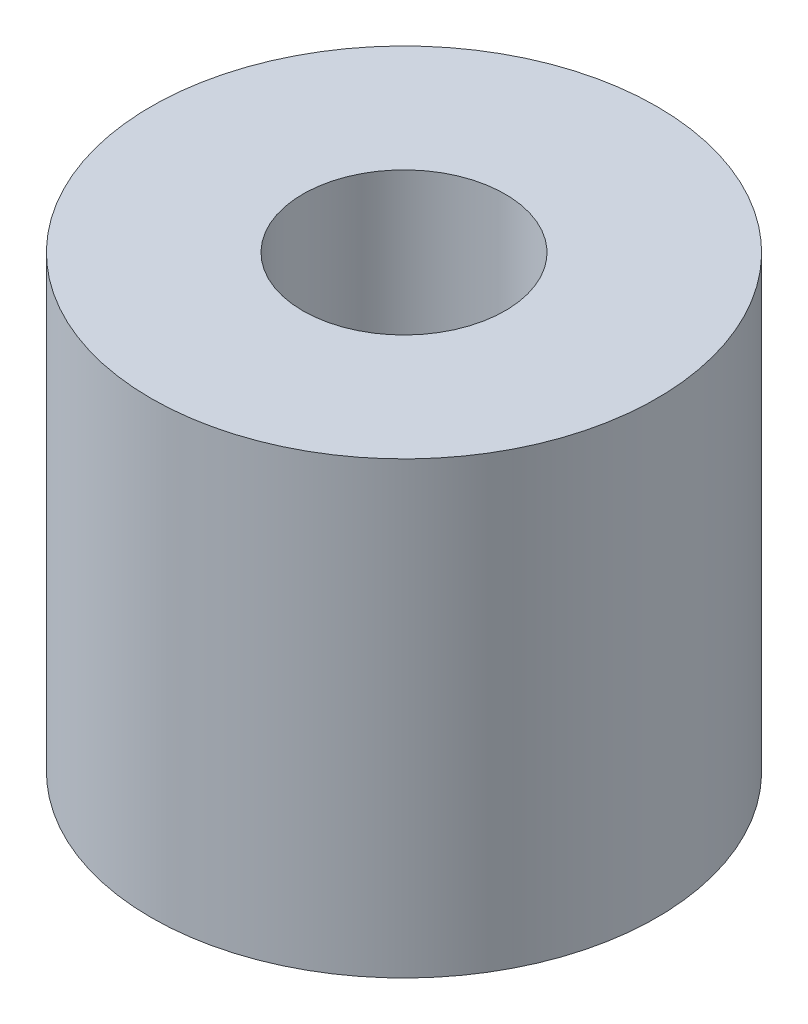
from build123d import *

# Parameters (mm, degrees)
CROQUIS1_R              = 4.5
CROQUIS1_R_2            = 1.8
SALIENTE_EXTRUIR1_DEPTH = 8


with BuildPart() as part:
    # Croquis1 → Saliente-Extruir1 (new body)
    with BuildSketch(Plane(origin=(0, 0, 0), x_dir=(1, 0, 0), z_dir=(0, 1, 0))):
        with Locations(Location((0, 0, 0), (0, 0, 270))):
            Circle(CROQUIS1_R)
        with Locations(Location((0, 0, 0), (0, 0, 270))):
            Circle(CROQUIS1_R_2, mode=Mode.SUBTRACT)
    extrude(amount=SALIENTE_EXTRUIR1_DEPTH)


solid = part.part
